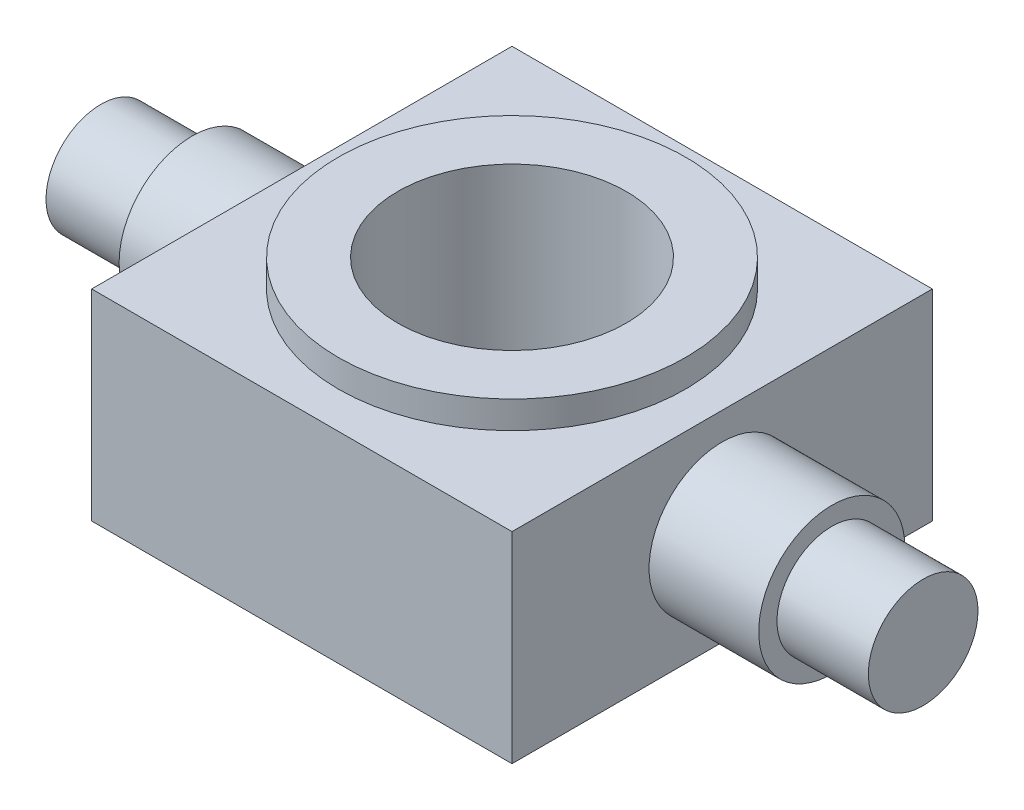
from build123d import *

# Parameters (mm, degrees)
ESBO_O1_W                 = 46
ESBO_O1_H                 = 46
ESBO_O1_R                 = 12.5
RESSALTO_EXTRUS_O1_DEPTH  = 22
ESBO_O1_7_R               = 19
ESBO_O1_7_R_2             = 12.5
RESSALTO_EXTRUS_O4_DEPTH  = 25
RESSALTO_EXTRUS_O5_START  = -3
ESBO_O1_8_R               = 19
ESBO_O1_8_R_2             = 12.5
RESSALTO_EXTRUS_O5_DEPTH  = 3
ESBO_O7_R                 = 8
ESBO_O7_R_2               = 6
RESSALTO_EXTRUS_O8_DEPTH  = 12
ESBO_O7_3_R               = 6
RESSALTO_EXTRUS_O9_DEPTH  = 22
RESSALTO_EXTRUS_O10_START = 12
ESBO_O8_R                 = 8
ESBO_O8_R_2               = 6
RESSALTO_EXTRUS_O10_DEPTH = 12
RESSALTO_EXTRUS_O11_START = 22
ESBO_O8_2_R               = 6
RESSALTO_EXTRUS_O11_DEPTH = 22


with BuildPart() as part:
    # Esboço1 → Ressalto-extrusão1 (new body)
    with BuildSketch(Plane(origin=(0, 0, 0), x_dir=(1, 0, 0), z_dir=(0, 1, 0))):
        Rectangle(ESBO_O1_W, ESBO_O1_H)
        Circle(ESBO_O1_R, mode=Mode.SUBTRACT)
    extrude(amount=RESSALTO_EXTRUS_O1_DEPTH)

    # Esboço1<7> → Ressalto-extrusão4 (add)
    with BuildSketch(Plane(origin=(0, 0, 0), x_dir=(1, 0, 0), z_dir=(0, 1, 0))):
        Circle(ESBO_O1_7_R)
        Circle(ESBO_O1_7_R_2, mode=Mode.SUBTRACT)
    extrude(amount=RESSALTO_EXTRUS_O4_DEPTH)

    # Esboço1<8> → Ressalto-extrusão5 (add)
    with BuildSketch(Plane(origin=(0, 0, 0), x_dir=(1, 0, 0), z_dir=(0, 1, 0)).offset(RESSALTO_EXTRUS_O5_START)):
        Circle(ESBO_O1_8_R)
        Circle(ESBO_O1_8_R_2, mode=Mode.SUBTRACT)
    extrude(amount=RESSALTO_EXTRUS_O5_DEPTH)

    # Esboço7 → Ressalto-extrusão8 (add)
    with BuildSketch(Plane.ZY.offset(23)):
        with Locations((0, 11)):
            Circle(ESBO_O7_R)
        with Locations((0, 11)):
            Circle(ESBO_O7_R_2, mode=Mode.SUBTRACT)
    extrude(amount=RESSALTO_EXTRUS_O8_DEPTH)

    # Esboço7<3> → Ressalto-extrusão9 (add)
    with BuildSketch(Plane.ZY.offset(23)):
        with Locations((0, 11)):
            Circle(ESBO_O7_3_R)
    extrude(amount=RESSALTO_EXTRUS_O9_DEPTH)

    # Esboço8 → Ressalto-extrusão10 (add)
    with BuildSketch(Plane(origin=(23, 0, 0), x_dir=(0, 0, -1), z_dir=(1, 0, 0)).offset(RESSALTO_EXTRUS_O10_START)):
        with Locations((0, 11)):
            Circle(ESBO_O8_R)
        with Locations((0, 11)):
            Circle(ESBO_O8_R_2, mode=Mode.SUBTRACT)
    extrude(amount=-RESSALTO_EXTRUS_O10_DEPTH)

    # Esboço8<2> → Ressalto-extrusão11 (add)
    with BuildSketch(Plane(origin=(23, 0, 0), x_dir=(0, 0, -1), z_dir=(1, 0, 0)).offset(RESSALTO_EXTRUS_O11_START)):
        with Locations((0, 11)):
            Circle(ESBO_O8_2_R)
    extrude(amount=-RESSALTO_EXTRUS_O11_DEPTH)


solid = part.part
